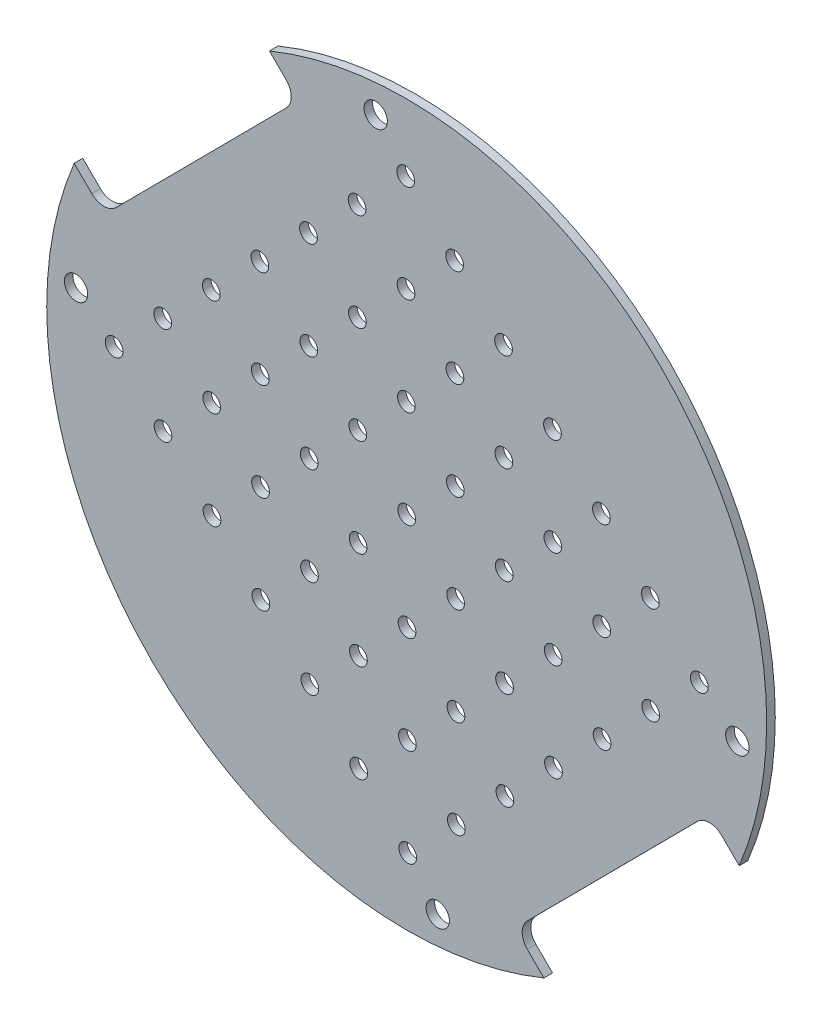
from build123d import *

# Parameters (mm, degrees)
SKETCH1_R             = 66.294
EXTRUDE1_DEPTH        = 1.5875
EXTRUDE3_DEPTH        = 94.767313219
CIRPATTERN4_COUNT     = 2
CIRPATTERN4_ANGLE     = 180
F_6_CLEARANCE_HOLE1_D = 4.3053
CIRPATTERN3_COUNT     = 2
CIRPATTERN3_ANGLE     = 180
LPATTERN1_COUNT       = 4
LPATTERN1_PITCH       = 12.7
LPATTERN1_COL_COUNT   = 4
LPATTERN1_COL_PITCH   = 12.7
LPATTERN2_COUNT       = 4
LPATTERN2_PITCH       = 12.7
LPATTERN2_COL_COUNT   = 4
LPATTERN2_COL_PITCH   = 12.7
FILLET1_R             = 3.175


with BuildPart() as part:
    # Sketch1 → Extrude1 (new body)
    with BuildSketch(Plane.XY):
        Circle(SKETCH1_R)
    extrude(amount=EXTRUDE1_DEPTH)

    # Sketch11 → Extrude3 (cut, through all)
    with BuildSketch(Plane(origin=(0, 0, 0), x_dir=(-1, 0, 0), z_dir=(0, 0, -1))):
        Polygon((-55.744942807, -19.950918323), (-68.929921306, -33.044311857), (-33.1343056, -69.090308809), (-19.949327102, -55.996915275), align=None)
    extrude3 = extrude(amount=-EXTRUDE3_DEPTH, mode=Mode.SUBTRACT)

    # CirPattern4: Extrude3 ×2 about axis
    cirpattern4_axis = Axis((0, 0, 0), (0, 0, 1))
    for i in range(1, CIRPATTERN4_COUNT):
        add(extrude3.rotate(cirpattern4_axis, i * CIRPATTERN4_ANGLE / (CIRPATTERN4_COUNT - 1)), mode=Mode.SUBTRACT)

    # #6 Clearance Hole1 (through all)
    with Locations(Plane(origin=(-5.715, 60.8965, 1.5875), x_dir=(1, 0, 0), z_dir=(0, 0, 1))):
        with Locations((0, 0), (66.6115, -66.6115)):
            f_6_clearance_hole1 = Hole(F_6_CLEARANCE_HOLE1_D / 2)

    # CirPattern3: #6 Clearance Hole1 ×2 about axis
    cirpattern3_axis = Axis((0, 0, 0), (0, 0, 1))
    for i in range(1, CIRPATTERN3_COUNT):
        add(f_6_clearance_hole1.rotate(cirpattern3_axis, i * CIRPATTERN3_ANGLE / (CIRPATTERN3_COUNT - 1)), mode=Mode.SUBTRACT)

    # Sketch13 → #4 Clearance Hole1 (revolve, cut)
    with BuildSketch(Plane(origin=(0, 0, 1.5875), x_dir=(0, -1, 0), z_dir=(1, 0, 0))):
        Polygon((0, 0), (0, 16.220574487), (1.63195, 15.24), (1.63195, 0), align=None)
    f_4_clearance_hole1 = revolve(axis=Axis((0, 0, 7.9375), (0, 0, -1)), mode=Mode.SUBTRACT)

    # LPattern1: #4 Clearance Hole1 ×4
    with Locations(*[Vector(0.7046381044424681, 0.709566869130546, 0) * (i * LPATTERN1_PITCH) for i in range(1, LPATTERN1_COUNT)]):
        add(f_4_clearance_hole1, mode=Mode.SUBTRACT)

    # LPattern1 col: #4 Clearance Hole1 ×4
    with Locations(*[Vector(-0.7046381044424681, -0.709566869130546, 0) * (i * LPATTERN1_COL_PITCH) for i in range(1, LPATTERN1_COL_COUNT)]):
        add(f_4_clearance_hole1, mode=Mode.SUBTRACT)

    # LPattern2: #4 Clearance Hole1 ×4
    with Locations(*[Vector(-0.709566869130546, 0.7046381044424682, 0) * (i * LPATTERN2_PITCH) for i in range(1, LPATTERN2_COUNT)]):
        add(f_4_clearance_hole1, mode=Mode.SUBTRACT)

    # LPattern2 copy 1 sketch → LPattern2 copy 1 (revolve, cut)
    with BuildSketch(Plane(origin=(-0.062595312, 17.960403164, 1.5875), x_dir=(0, -1, 0), z_dir=(1, 0, 0))):
        Polygon((0, 0), (0, 16.220574487), (1.63195, 15.24), (1.63195, 0), align=None)
    revolve(axis=Axis((-0.062595312, 17.960403164, 7.9375), (0, 0, -1)), mode=Mode.SUBTRACT)

    # LPattern2 copy 2 sketch → LPattern2 copy 2 (revolve, cut)
    with BuildSketch(Plane(origin=(-9.074094549, 26.909307091, 1.5875), x_dir=(0, -1, 0), z_dir=(1, 0, 0))):
        Polygon((0, 0), (0, 16.220574487), (1.63195, 15.24), (1.63195, 0), align=None)
    revolve(axis=Axis((-9.074094549, 26.909307091, 7.9375), (0, 0, -1)), mode=Mode.SUBTRACT)

    # LPattern2 copy 3 sketch → LPattern2 copy 3 (revolve, cut)
    with BuildSketch(Plane(origin=(-18.085593787, 35.858211017, 1.5875), x_dir=(0, -1, 0), z_dir=(1, 0, 0))):
        Polygon((0, 0), (0, 16.220574487), (1.63195, 15.24), (1.63195, 0), align=None)
    revolve(axis=Axis((-18.085593787, 35.858211017, 7.9375), (0, 0, -1)), mode=Mode.SUBTRACT)

    # LPattern2 copy 4 sketch → LPattern2 copy 4 (revolve, cut)
    with BuildSketch(Plane(origin=(8.886308615, 26.971902402, 1.5875), x_dir=(0, -1, 0), z_dir=(1, 0, 0))):
        Polygon((0, 0), (0, 16.220574487), (1.63195, 15.24), (1.63195, 0), align=None)
    revolve(axis=Axis((8.886308615, 26.971902402, 7.9375), (0, 0, -1)), mode=Mode.SUBTRACT)

    # LPattern2 copy 5 sketch → LPattern2 copy 5 (revolve, cut)
    with BuildSketch(Plane(origin=(-0.125190623, 35.920806329, 1.5875), x_dir=(0, -1, 0), z_dir=(1, 0, 0))):
        Polygon((0, 0), (0, 16.220574487), (1.63195, 15.24), (1.63195, 0), align=None)
    revolve(axis=Axis((-0.125190623, 35.920806329, 7.9375), (0, 0, -1)), mode=Mode.SUBTRACT)

    # LPattern2 copy 6 sketch → LPattern2 copy 6 (revolve, cut)
    with BuildSketch(Plane(origin=(-9.136689861, 44.869710255, 1.5875), x_dir=(0, -1, 0), z_dir=(1, 0, 0))):
        Polygon((0, 0), (0, 16.220574487), (1.63195, 15.24), (1.63195, 0), align=None)
    revolve(axis=Axis((-9.136689861, 44.869710255, 7.9375), (0, 0, -1)), mode=Mode.SUBTRACT)

    # LPattern2 copy 7 sketch → LPattern2 copy 7 (revolve, cut)
    with BuildSketch(Plane(origin=(17.835212541, 35.98340164, 1.5875), x_dir=(0, -1, 0), z_dir=(1, 0, 0))):
        Polygon((0, 0), (0, 16.220574487), (1.63195, 15.24), (1.63195, 0), align=None)
    revolve(axis=Axis((17.835212541, 35.98340164, 7.9375), (0, 0, -1)), mode=Mode.SUBTRACT)

    # LPattern2 copy 8 sketch → LPattern2 copy 8 (revolve, cut)
    with BuildSketch(Plane(origin=(8.823713303, 44.932305567, 1.5875), x_dir=(0, -1, 0), z_dir=(1, 0, 0))):
        Polygon((0, 0), (0, 16.220574487), (1.63195, 15.24), (1.63195, 0), align=None)
    revolve(axis=Axis((8.823713303, 44.932305567, 7.9375), (0, 0, -1)), mode=Mode.SUBTRACT)

    # LPattern2 copy 9 sketch → LPattern2 copy 9 (revolve, cut)
    with BuildSketch(Plane(origin=(-0.187785935, 53.881209493, 1.5875), x_dir=(0, -1, 0), z_dir=(1, 0, 0))):
        Polygon((0, 0), (0, 16.220574487), (1.63195, 15.24), (1.63195, 0), align=None)
    revolve(axis=Axis((-0.187785935, 53.881209493, 7.9375), (0, 0, -1)), mode=Mode.SUBTRACT)

    # LPattern2 copy 10 sketch → LPattern2 copy 10 (revolve, cut)
    with BuildSketch(Plane(origin=(-17.960403164, -0.062595312, 1.5875), x_dir=(0, -1, 0), z_dir=(1, 0, 0))):
        Polygon((0, 0), (0, 16.220574487), (1.63195, 15.24), (1.63195, 0), align=None)
    revolve(axis=Axis((-17.960403164, -0.062595312, 7.9375), (0, 0, -1)), mode=Mode.SUBTRACT)

    # LPattern2 copy 11 sketch → LPattern2 copy 11 (revolve, cut)
    with BuildSketch(Plane(origin=(-26.971902402, 8.886308615, 1.5875), x_dir=(0, -1, 0), z_dir=(1, 0, 0))):
        Polygon((0, 0), (0, 16.220574487), (1.63195, 15.24), (1.63195, 0), align=None)
    revolve(axis=Axis((-26.971902402, 8.886308615, 7.9375), (0, 0, -1)), mode=Mode.SUBTRACT)

    # LPattern2 copy 12 sketch → LPattern2 copy 12 (revolve, cut)
    with BuildSketch(Plane(origin=(-35.98340164, 17.835212541, 1.5875), x_dir=(0, -1, 0), z_dir=(1, 0, 0))):
        Polygon((0, 0), (0, 16.220574487), (1.63195, 15.24), (1.63195, 0), align=None)
    revolve(axis=Axis((-35.98340164, 17.835212541, 7.9375), (0, 0, -1)), mode=Mode.SUBTRACT)

    # LPattern2 copy 13 sketch → LPattern2 copy 13 (revolve, cut)
    with BuildSketch(Plane(origin=(-26.909307091, -9.074094549, 1.5875), x_dir=(0, -1, 0), z_dir=(1, 0, 0))):
        Polygon((0, 0), (0, 16.220574487), (1.63195, 15.24), (1.63195, 0), align=None)
    revolve(axis=Axis((-26.909307091, -9.074094549, 7.9375), (0, 0, -1)), mode=Mode.SUBTRACT)

    # LPattern2 copy 14 sketch → LPattern2 copy 14 (revolve, cut)
    with BuildSketch(Plane(origin=(-35.920806329, -0.125190623, 1.5875), x_dir=(0, -1, 0), z_dir=(1, 0, 0))):
        Polygon((0, 0), (0, 16.220574487), (1.63195, 15.24), (1.63195, 0), align=None)
    revolve(axis=Axis((-35.920806329, -0.125190623, 7.9375), (0, 0, -1)), mode=Mode.SUBTRACT)

    # LPattern2 copy 15 sketch → LPattern2 copy 15 (revolve, cut)
    with BuildSketch(Plane(origin=(-44.932305567, 8.823713303, 1.5875), x_dir=(0, -1, 0), z_dir=(1, 0, 0))):
        Polygon((0, 0), (0, 16.220574487), (1.63195, 15.24), (1.63195, 0), align=None)
    revolve(axis=Axis((-44.932305567, 8.823713303, 7.9375), (0, 0, -1)), mode=Mode.SUBTRACT)

    # LPattern2 copy 16 sketch → LPattern2 copy 16 (revolve, cut)
    with BuildSketch(Plane(origin=(-35.858211017, -18.085593787, 1.5875), x_dir=(0, -1, 0), z_dir=(1, 0, 0))):
        Polygon((0, 0), (0, 16.220574487), (1.63195, 15.24), (1.63195, 0), align=None)
    revolve(axis=Axis((-35.858211017, -18.085593787, 7.9375), (0, 0, -1)), mode=Mode.SUBTRACT)

    # LPattern2 copy 17 sketch → LPattern2 copy 17 (revolve, cut)
    with BuildSketch(Plane(origin=(-44.869710255, -9.136689861, 1.5875), x_dir=(0, -1, 0), z_dir=(1, 0, 0))):
        Polygon((0, 0), (0, 16.220574487), (1.63195, 15.24), (1.63195, 0), align=None)
    revolve(axis=Axis((-44.869710255, -9.136689861, 7.9375), (0, 0, -1)), mode=Mode.SUBTRACT)

    # LPattern2 copy 18 sketch → LPattern2 copy 18 (revolve, cut)
    with BuildSketch(Plane(origin=(-53.881209493, -0.187785935, 1.5875), x_dir=(0, -1, 0), z_dir=(1, 0, 0))):
        Polygon((0, 0), (0, 16.220574487), (1.63195, 15.24), (1.63195, 0), align=None)
    revolve(axis=Axis((-53.881209493, -0.187785935, 7.9375), (0, 0, -1)), mode=Mode.SUBTRACT)

    # LPattern2 col: #4 Clearance Hole1 ×4
    with Locations(*[Vector(0.7095668691305516, -0.7046381044424626, 0) * (i * LPATTERN2_COL_PITCH) for i in range(1, LPATTERN2_COL_COUNT)]):
        add(f_4_clearance_hole1, mode=Mode.SUBTRACT)

    # LPattern2 col copy 1 sketch → LPattern2 col copy 1 (revolve, cut)
    with BuildSketch(Plane(origin=(17.960403164, 0.062595312, 1.5875), x_dir=(0, -1, 0), z_dir=(1, 0, 0))):
        Polygon((0, 0), (0, 16.220574487), (1.63195, 15.24), (1.63195, 0), align=None)
    revolve(axis=Axis((17.960403164, 0.062595312, 7.9375), (0, 0, -1)), mode=Mode.SUBTRACT)

    # LPattern2 col copy 2 sketch → LPattern2 col copy 2 (revolve, cut)
    with BuildSketch(Plane(origin=(26.971902402, -8.886308615, 1.5875), x_dir=(0, -1, 0), z_dir=(1, 0, 0))):
        Polygon((0, 0), (0, 16.220574487), (1.63195, 15.24), (1.63195, 0), align=None)
    revolve(axis=Axis((26.971902402, -8.886308615, 7.9375), (0, 0, -1)), mode=Mode.SUBTRACT)

    # LPattern2 col copy 3 sketch → LPattern2 col copy 3 (revolve, cut)
    with BuildSketch(Plane(origin=(35.98340164, -17.835212541, 1.5875), x_dir=(0, -1, 0), z_dir=(1, 0, 0))):
        Polygon((0, 0), (0, 16.220574487), (1.63195, 15.24), (1.63195, 0), align=None)
    revolve(axis=Axis((35.98340164, -17.835212541, 7.9375), (0, 0, -1)), mode=Mode.SUBTRACT)

    # LPattern2 col copy 4 sketch → LPattern2 col copy 4 (revolve, cut)
    with BuildSketch(Plane(origin=(26.909307091, 9.074094549, 1.5875), x_dir=(0, -1, 0), z_dir=(1, 0, 0))):
        Polygon((0, 0), (0, 16.220574487), (1.63195, 15.24), (1.63195, 0), align=None)
    revolve(axis=Axis((26.909307091, 9.074094549, 7.9375), (0, 0, -1)), mode=Mode.SUBTRACT)

    # LPattern2 col copy 5 sketch → LPattern2 col copy 5 (revolve, cut)
    with BuildSketch(Plane(origin=(35.920806329, 0.125190623, 1.5875), x_dir=(0, -1, 0), z_dir=(1, 0, 0))):
        Polygon((0, 0), (0, 16.220574487), (1.63195, 15.24), (1.63195, 0), align=None)
    revolve(axis=Axis((35.920806329, 0.125190623, 7.9375), (0, 0, -1)), mode=Mode.SUBTRACT)

    # LPattern2 col copy 6 sketch → LPattern2 col copy 6 (revolve, cut)
    with BuildSketch(Plane(origin=(44.932305567, -8.823713303, 1.5875), x_dir=(0, -1, 0), z_dir=(1, 0, 0))):
        Polygon((0, 0), (0, 16.220574487), (1.63195, 15.24), (1.63195, 0), align=None)
    revolve(axis=Axis((44.932305567, -8.823713303, 7.9375), (0, 0, -1)), mode=Mode.SUBTRACT)

    # LPattern2 col copy 7 sketch → LPattern2 col copy 7 (revolve, cut)
    with BuildSketch(Plane(origin=(35.858211017, 18.085593787, 1.5875), x_dir=(0, -1, 0), z_dir=(1, 0, 0))):
        Polygon((0, 0), (0, 16.220574487), (1.63195, 15.24), (1.63195, 0), align=None)
    revolve(axis=Axis((35.858211017, 18.085593787, 7.9375), (0, 0, -1)), mode=Mode.SUBTRACT)

    # LPattern2 col copy 8 sketch → LPattern2 col copy 8 (revolve, cut)
    with BuildSketch(Plane(origin=(44.869710255, 9.136689861, 1.5875), x_dir=(0, -1, 0), z_dir=(1, 0, 0))):
        Polygon((0, 0), (0, 16.220574487), (1.63195, 15.24), (1.63195, 0), align=None)
    revolve(axis=Axis((44.869710255, 9.136689861, 7.9375), (0, 0, -1)), mode=Mode.SUBTRACT)

    # LPattern2 col copy 9 sketch → LPattern2 col copy 9 (revolve, cut)
    with BuildSketch(Plane(origin=(53.881209493, 0.187785935, 1.5875), x_dir=(0, -1, 0), z_dir=(1, 0, 0))):
        Polygon((0, 0), (0, 16.220574487), (1.63195, 15.24), (1.63195, 0), align=None)
    revolve(axis=Axis((53.881209493, 0.187785935, 7.9375), (0, 0, -1)), mode=Mode.SUBTRACT)

    # LPattern2 col copy 10 sketch → LPattern2 col copy 10 (revolve, cut)
    with BuildSketch(Plane(origin=(0.062595312, -17.960403164, 1.5875), x_dir=(0, -1, 0), z_dir=(1, 0, 0))):
        Polygon((0, 0), (0, 16.220574487), (1.63195, 15.24), (1.63195, 0), align=None)
    revolve(axis=Axis((0.062595312, -17.960403164, 7.9375), (0, 0, -1)), mode=Mode.SUBTRACT)

    # LPattern2 col copy 11 sketch → LPattern2 col copy 11 (revolve, cut)
    with BuildSketch(Plane(origin=(9.074094549, -26.909307091, 1.5875), x_dir=(0, -1, 0), z_dir=(1, 0, 0))):
        Polygon((0, 0), (0, 16.220574487), (1.63195, 15.24), (1.63195, 0), align=None)
    revolve(axis=Axis((9.074094549, -26.909307091, 7.9375), (0, 0, -1)), mode=Mode.SUBTRACT)

    # LPattern2 col copy 12 sketch → LPattern2 col copy 12 (revolve, cut)
    with BuildSketch(Plane(origin=(18.085593787, -35.858211017, 1.5875), x_dir=(0, -1, 0), z_dir=(1, 0, 0))):
        Polygon((0, 0), (0, 16.220574487), (1.63195, 15.24), (1.63195, 0), align=None)
    revolve(axis=Axis((18.085593787, -35.858211017, 7.9375), (0, 0, -1)), mode=Mode.SUBTRACT)

    # LPattern2 col copy 13 sketch → LPattern2 col copy 13 (revolve, cut)
    with BuildSketch(Plane(origin=(-8.886308615, -26.971902402, 1.5875), x_dir=(0, -1, 0), z_dir=(1, 0, 0))):
        Polygon((0, 0), (0, 16.220574487), (1.63195, 15.24), (1.63195, 0), align=None)
    revolve(axis=Axis((-8.886308615, -26.971902402, 7.9375), (0, 0, -1)), mode=Mode.SUBTRACT)

    # LPattern2 col copy 14 sketch → LPattern2 col copy 14 (revolve, cut)
    with BuildSketch(Plane(origin=(0.125190623, -35.920806329, 1.5875), x_dir=(0, -1, 0), z_dir=(1, 0, 0))):
        Polygon((0, 0), (0, 16.220574487), (1.63195, 15.24), (1.63195, 0), align=None)
    revolve(axis=Axis((0.125190623, -35.920806329, 7.9375), (0, 0, -1)), mode=Mode.SUBTRACT)

    # LPattern2 col copy 15 sketch → LPattern2 col copy 15 (revolve, cut)
    with BuildSketch(Plane(origin=(9.136689861, -44.869710255, 1.5875), x_dir=(0, -1, 0), z_dir=(1, 0, 0))):
        Polygon((0, 0), (0, 16.220574487), (1.63195, 15.24), (1.63195, 0), align=None)
    revolve(axis=Axis((9.136689861, -44.869710255, 7.9375), (0, 0, -1)), mode=Mode.SUBTRACT)

    # LPattern2 col copy 16 sketch → LPattern2 col copy 16 (revolve, cut)
    with BuildSketch(Plane(origin=(-17.835212541, -35.98340164, 1.5875), x_dir=(0, -1, 0), z_dir=(1, 0, 0))):
        Polygon((0, 0), (0, 16.220574487), (1.63195, 15.24), (1.63195, 0), align=None)
    revolve(axis=Axis((-17.835212541, -35.98340164, 7.9375), (0, 0, -1)), mode=Mode.SUBTRACT)

    # LPattern2 col copy 17 sketch → LPattern2 col copy 17 (revolve, cut)
    with BuildSketch(Plane(origin=(-8.823713303, -44.932305567, 1.5875), x_dir=(0, -1, 0), z_dir=(1, 0, 0))):
        Polygon((0, 0), (0, 16.220574487), (1.63195, 15.24), (1.63195, 0), align=None)
    revolve(axis=Axis((-8.823713303, -44.932305567, 7.9375), (0, 0, -1)), mode=Mode.SUBTRACT)

    # LPattern2 col copy 18 sketch → LPattern2 col copy 18 (revolve, cut)
    with BuildSketch(Plane(origin=(0.187785935, -53.881209493, 1.5875), x_dir=(0, -1, 0), z_dir=(1, 0, 0))):
        Polygon((0, 0), (0, 16.220574487), (1.63195, 15.24), (1.63195, 0), align=None)
    revolve(axis=Axis((0.187785935, -53.881209493, 7.9375), (0, 0, -1)), mode=Mode.SUBTRACT)

    # Fillet1
    fillet1_edges = [part.edges().sort_by_distance(p)[0] for p in [
        (19.949327102, -55.996915275, 0.79375),
        (55.744942807, -19.950918323, 0.79375),
        (-19.949327102, 55.996915275, 0.79375),
        (-55.744942807, 19.950918323, 0.79375),
    ]]
    fillet(fillet1_edges, radius=FILLET1_R)


solid = part.part
